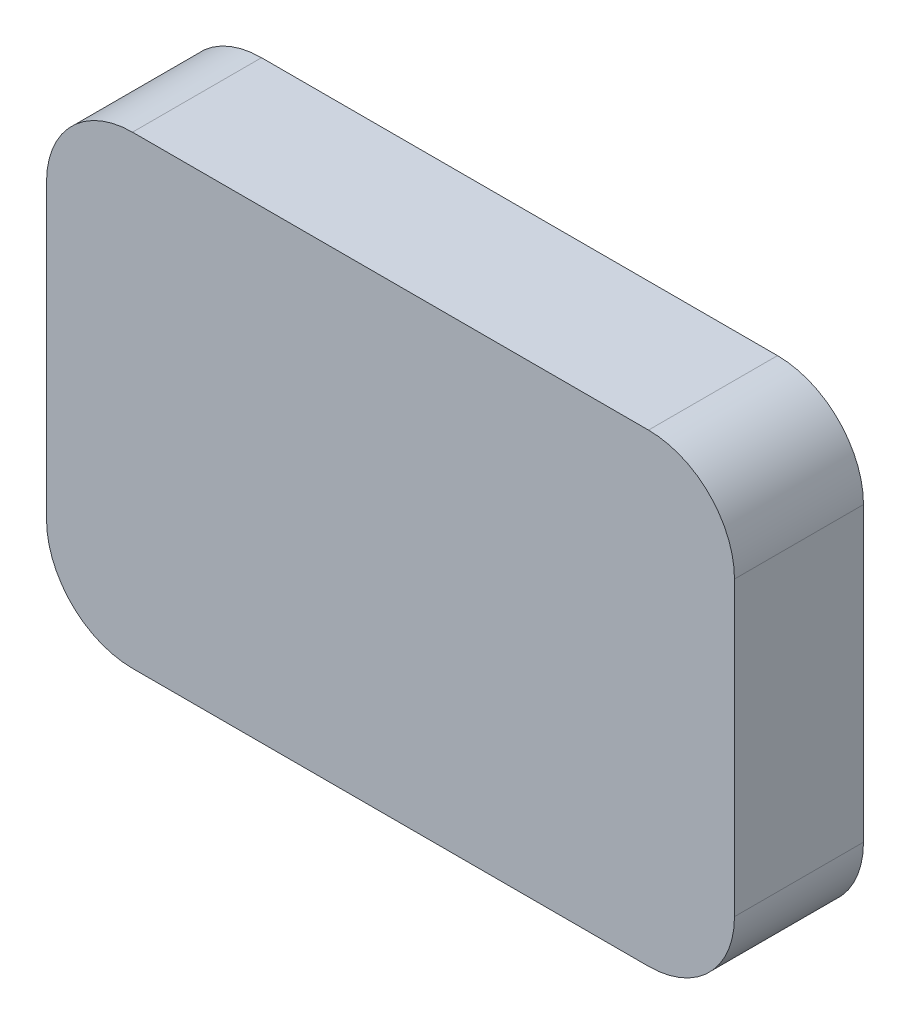
from build123d import *

# Parameters (mm, degrees)
SKETCH1_W           = 80
SKETCH1_H           = 54
BOSS_EXTRUDE1_DEPTH = 15
FILLET1_R           = 10


with BuildPart() as part:
    # Sketch1 → Boss-Extrude1 (new body)
    with BuildSketch(Plane.XY):
        with Locations((40, -27)):
            Rectangle(SKETCH1_W, SKETCH1_H)
    extrude(amount=BOSS_EXTRUDE1_DEPTH)

    # Fillet1
    fillet1_edges = [part.edges().sort_by_distance(p)[0] for p in [
        (0, 0, 7.5),
        (80, 0, 7.5),
        (80, -54, 7.5),
        (0, -54, 7.5),
    ]]
    fillet(fillet1_edges, radius=FILLET1_R)


solid = part.part
